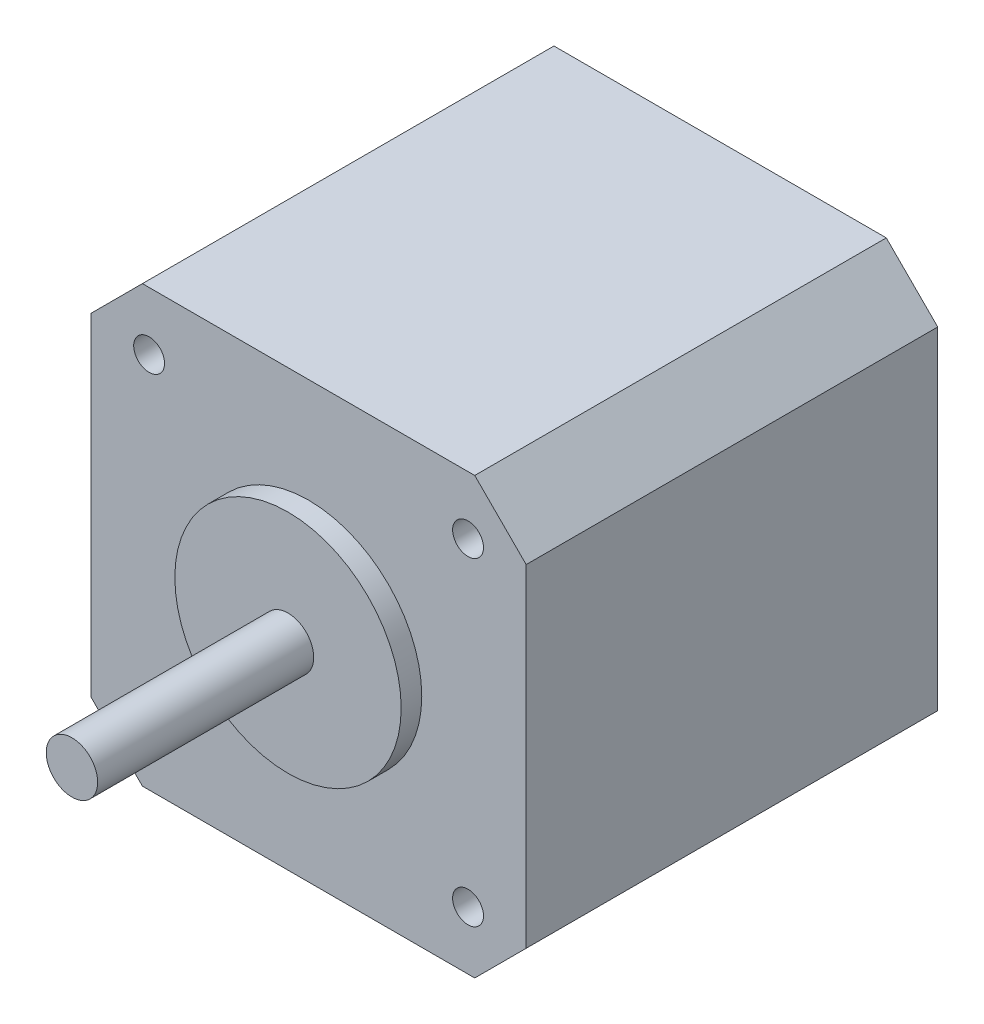
from build123d import *

# Parameters (mm, degrees)
CROQUIS1_W              = 42.3
CROQUIS1_H              = 42.3
CROQUIS1_R              = 1.5
SALIENTE_EXTRUIR1_DEPTH = 20
CROQUIS2_R              = 11
SALIENTE_EXTRUIR2_DEPTH = 2
CROQUIS3_R              = 2.5
SALIENTE_EXTRUIR3_DEPTH = 23
CHAFL_N1_SIZE           = 5


with BuildPart() as part:
    # Croquis1 → Saliente-Extruir1 (new, symmetric)
    with BuildSketch(Plane.XY):
        Rectangle(CROQUIS1_W, CROQUIS1_H)
        with Locations((-15.5, 15.5)):
            Circle(CROQUIS1_R, mode=Mode.SUBTRACT)
        with Locations((-15.5, -15.5)):
            Circle(CROQUIS1_R, mode=Mode.SUBTRACT)
        with Locations(Location((15.5, -15.5, 0), (0, 0, 180))):
            Circle(CROQUIS1_R, mode=Mode.SUBTRACT)
        with Locations(Location((15.5, 15.5, 0), (0, 0, 180))):
            Circle(CROQUIS1_R, mode=Mode.SUBTRACT)
    extrude(amount=SALIENTE_EXTRUIR1_DEPTH, both=True)

    # Croquis2 → Saliente-Extruir2 (add)
    with BuildSketch(Plane.XY.offset(20)):
        Circle(CROQUIS2_R)
    extrude(amount=SALIENTE_EXTRUIR2_DEPTH)

    # Croquis3 → Saliente-Extruir3 (add)
    with BuildSketch(Plane.XY.offset(20)):
        Circle(CROQUIS3_R)
    extrude(amount=SALIENTE_EXTRUIR3_DEPTH)

    # Chaflán1
    chafl_n1_edges = [part.edges().sort_by_distance(p)[0] for p in [
        (-21.15, 21.15, 0),
        (21.15, 21.15, 0),
        (21.15, -21.15, 0),
        (-21.15, -21.15, 0),
    ]]
    chamfer(chafl_n1_edges, length=CHAFL_N1_SIZE)


solid = part.part
